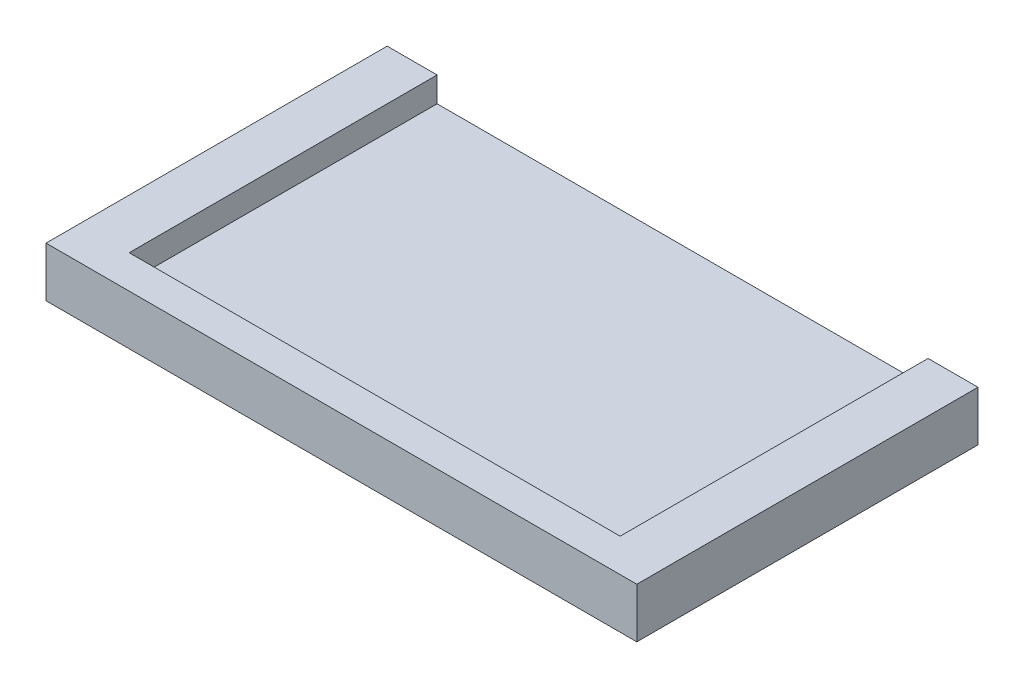
from build123d import *

# Parameters (mm, degrees)
SKETCH1_W           = 35.5
SKETCH1_H           = 20.5
BOSS_EXTRUDE1_DEPTH = 1.5
BOSS_EXTRUDE2_DEPTH = 1.5


with BuildPart() as part:
    # Sketch1 → Boss-Extrude1 (new body)
    with BuildSketch(Plane(origin=(0, 0, 0), x_dir=(1, 0, 0), z_dir=(0, 1, 0))):
        Rectangle(SKETCH1_W, SKETCH1_H)
    extrude(amount=BOSS_EXTRUDE1_DEPTH)

    # Sketch2 → Boss-Extrude2 (add)
    with BuildSketch(Plane(origin=(0, 1.5, 0), x_dir=(1, 0, 0), z_dir=(0, 1, 0))):
        Polygon((17.75, 10.25), (14.75, 10.25), (14.75, -8.25), (-14.75, -8.25), (-14.75, 10.25), (-17.75, 10.25), (-17.75, -10.25), (17.75, -10.25), align=None)
    extrude(amount=BOSS_EXTRUDE2_DEPTH)


solid = part.part
